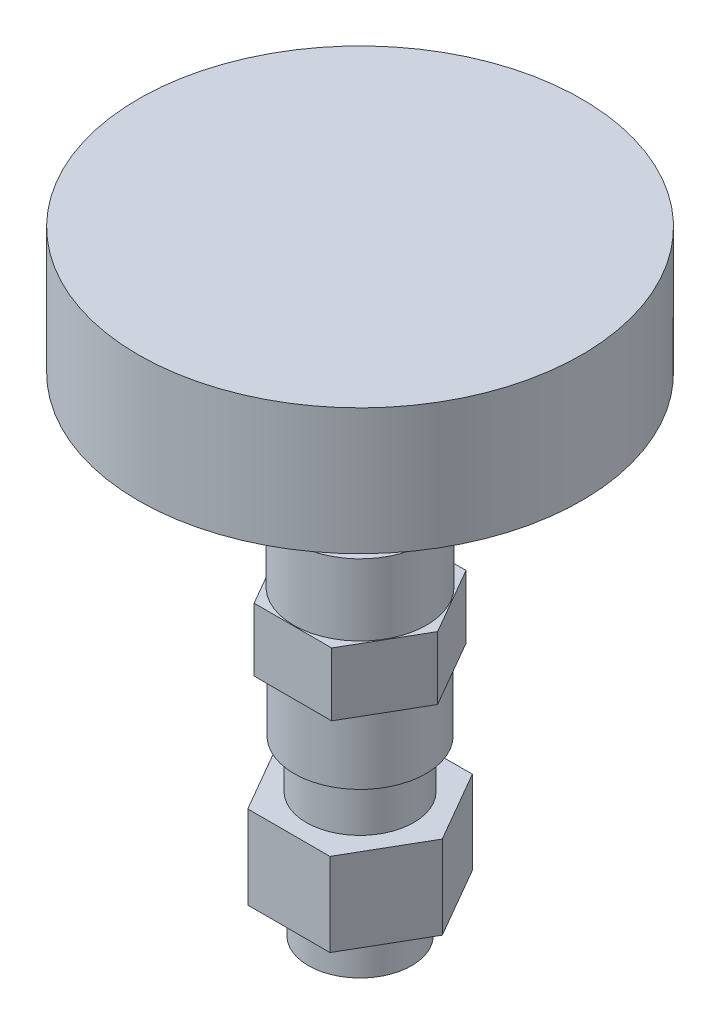
from build123d import *

# Parameters (mm, degrees)
SKETCH1_R           = 4.8895
BOSS_EXTRUDE1_DEPTH = 3.937
BOSS_EXTRUDE2_DEPTH = 7.874
SKETCH3_R           = 5.08
BOSS_EXTRUDE3_DEPTH = 4.572
SKETCH4_R           = 6.223
BOSS_EXTRUDE4_DEPTH = 6.223
BOSS_EXTRUDE5_DEPTH = 5.969
SKETCH6_R           = 6.2865
BOSS_EXTRUDE6_DEPTH = 6.731
SKETCH7_R           = 5.2705
BOSS_EXTRUDE7_DEPTH = 4.318
SKETCH9_W           = 10.922
SKETCH9_H           = 10.922
BOSS_EXTRUDE8_DEPTH = 6.477
SKETCH10_R          = 20.955
BOSS_EXTRUDE9_DEPTH = 11.938
SKETCH11_R          = 3.18135
CUT_EXTRUDE1_DEPTH  = 11.938


with BuildPart() as part:
    # Sketch1 → Boss-Extrude1 (new body)
    with BuildSketch(Plane(origin=(0, 0, 0), x_dir=(1, 0, 0), z_dir=(0, 1, 0))):
        with Locations(Location((0, 0, 0), (0, 0, 270))):
            Circle(SKETCH1_R)
    extrude(amount=BOSS_EXTRUDE1_DEPTH)

    # Sketch2 → Boss-Extrude2 (add)
    with BuildSketch(Plane(origin=(0, 3.937, 0), x_dir=(1, 0, 0), z_dir=(0, 1, 0))):
        Polygon((7.772289324, 0), (3.886144662, 6.731), (-3.886144662, 6.731), (-7.772289324, 0), (-3.886144662, -6.731), (3.886144662, -6.731), align=None)
    extrude(amount=BOSS_EXTRUDE2_DEPTH)

    # Sketch3 → Boss-Extrude3 (add)
    with BuildSketch(Plane(origin=(0, 11.811, 0), x_dir=(1, 0, 0), z_dir=(0, 1, 0))):
        with Locations(Location((0, 0, 0), (0, 0, 270))):
            Circle(SKETCH3_R)
    extrude(amount=BOSS_EXTRUDE3_DEPTH)

    # Sketch4 → Boss-Extrude4 (add)
    with BuildSketch(Plane(origin=(0, 16.383, 0), x_dir=(1, 0, 0), z_dir=(0, 1, 0))):
        with Locations(Location((0, 0, 0), (0, 0, 270))):
            Circle(SKETCH4_R)
    extrude(amount=BOSS_EXTRUDE4_DEPTH)

    # Sketch5 → Boss-Extrude5 (add)
    with BuildSketch(Plane(origin=(0, 22.606, 0), x_dir=(1, 0, 0), z_dir=(0, 1, 0))):
        Polygon((7.332348419, 0), (3.666174209, 6.35), (-3.666174209, 6.35), (-7.332348419, 0), (-3.666174209, -6.35), (3.666174209, -6.35), align=None)
    extrude(amount=BOSS_EXTRUDE5_DEPTH)

    # Sketch6 → Boss-Extrude6 (add)
    with BuildSketch(Plane(origin=(0, 28.575, 0), x_dir=(1, 0, 0), z_dir=(0, 1, 0))):
        with Locations(Location((0, 0, 0), (0, 0, 270))):
            Circle(SKETCH6_R)
    extrude(amount=BOSS_EXTRUDE6_DEPTH)

    # Sketch7 → Boss-Extrude7 (add)
    with BuildSketch(Plane(origin=(0, 35.306, 0), x_dir=(1, 0, 0), z_dir=(0, 1, 0))):
        with Locations(Location((0, 0, 0), (0, 0, 270))):
            Circle(SKETCH7_R)
    extrude(amount=BOSS_EXTRUDE7_DEPTH)

    # Sketch9 → Boss-Extrude8 (add)
    with BuildSketch(Plane(origin=(0, 39.624, 0), x_dir=(1, 0, 0), z_dir=(0, 1, 0))):
        Rectangle(SKETCH9_W, SKETCH9_H)
    extrude(amount=BOSS_EXTRUDE8_DEPTH)

    # Sketch10 → Boss-Extrude9 (add)
    with BuildSketch(Plane(origin=(0, 46.101, 0), x_dir=(1, 0, 0), z_dir=(0, 1, 0))):
        with Locations(Location((0, 0, 0), (0, 0, 270))):
            Circle(SKETCH10_R)
    extrude(amount=BOSS_EXTRUDE9_DEPTH)

    # Sketch11 → Cut-Extrude1 (cut)
    with BuildSketch(Plane.XZ):
        with Locations(Location((0, 0, 0), (0, 0, 270))):
            Circle(SKETCH11_R)
    extrude(amount=-CUT_EXTRUDE1_DEPTH, mode=Mode.SUBTRACT)


solid = part.part
